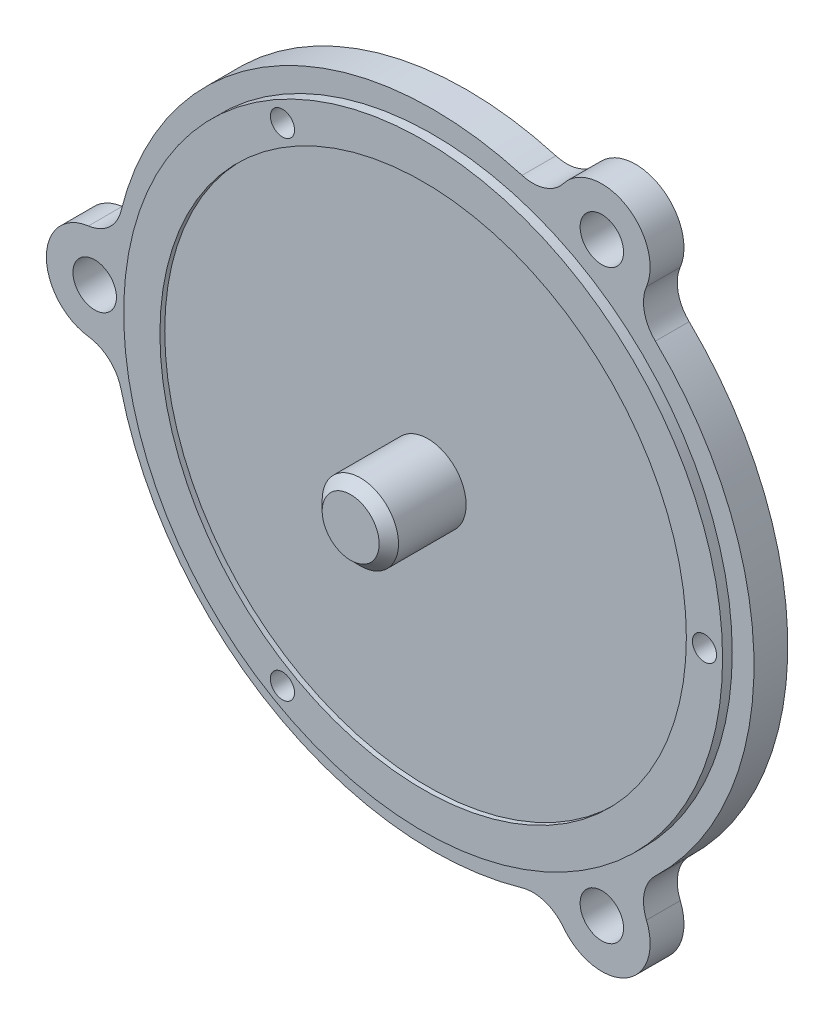
from build123d import *

# Parameters (mm, degrees)
ESQUISSE1_R                        = 31.25
BOSS_EXTRU_1_DEPTH                 = 2
BOSS_EXTRU_2_DEPTH                 = 25.5
BOSS_EXTRU_2_DEPTH_BACK            = 2
ESQUISSE2_R                        = 33.25
ESQUISSE2_R_2                      = 31.25
ESQUISSE3_R                        = 7.95
BOSS_EXTRU_3_DEPTH                 = 7.5
ESQUISSE4_R                        = 3.95
BOSS_EXTRU_4_DEPTH                 = 8
CHANFREIN1_SIZE                    = 1
BOSS_EXTRU_5_DEPTH                 = 27.5
ESQUISSE6_R                        = 1.75
ENL_V_MAT_EXTRU_1_DEPTH            = 10
CONG_1_R                           = 4
R_P_TITION_CIRCULAIRE2_COUNT       = 3
CONG_1_OF_R_P_TITION_CIRCULAIRE2_R = 4
ENL_V_MAT_EXTRU_2_DEPTH            = 25.5
ESQUISSE8_R                        = 3.95
BOSS_EXTRU_6_DEPTH                 = 8
ESQUISSE9_R                        = 2.25
ENL_V_MAT_EXTRU_3_DEPTH            = 54.952376281
CHANFREIN2_SIZE                    = 1
ESQUISSE10_R                       = 31
ESQUISSE10_R_2                     = 27.25
BOSS_EXTRU_7_DEPTH                 = 0.5
ESQUISSE11_R                       = 31
ENL_V_MAT_EXTRU_4_DEPTH            = 0.5
ESQUISSE12_R                       = 2.25
BOSS_EXTRU_8_DEPTH                 = 2
ESQUISSE13_R                       = 1.25
ENL_V_MAT_EXTRU_5_DEPTH            = 54.88050581


with BuildPart() as part:
    # Esquisse1 → Boss.-Extru.1 (new body)
    with BuildSketch(Plane.XY):
        Circle(ESQUISSE1_R)
    extrude(amount=BOSS_EXTRU_1_DEPTH)

    # Esquisse2 → Boss.-Extru.2 (add, two sides: drawn at the far end of the back side and taken through both)
    with BuildSketch(Plane.XY.offset(2).offset(-BOSS_EXTRU_2_DEPTH_BACK)):
        Circle(ESQUISSE2_R)
        Circle(ESQUISSE2_R_2, mode=Mode.SUBTRACT)
    extrude(amount=BOSS_EXTRU_2_DEPTH + BOSS_EXTRU_2_DEPTH_BACK)

    # Esquisse3 → Boss.-Extru.3 (add)
    with BuildSketch(Plane.XY.offset(2)):
        Circle(ESQUISSE3_R)
    extrude(amount=BOSS_EXTRU_3_DEPTH)

    # Esquisse4 → Boss.-Extru.4 (add)
    with BuildSketch(Plane.XY.offset(9.5)):
        Circle(ESQUISSE4_R)
    extrude(amount=BOSS_EXTRU_4_DEPTH)

    # Chanfrein1
    chanfrein1_edges = [part.edges().sort_by_distance(p)[0] for p in [
        (-7.95, 0, 9.5),
        (-3.95, 0, 17.5),
    ]]
    chamfer(chanfrein1_edges, length=CHANFREIN1_SIZE)

    # Esquisse5 → Boss.-Extru.5 (add)
    with BuildSketch(Plane.XY.offset(27.5)):
        with BuildLine():
            ThreePointArc((-32.936607143, -4.554383594), (-40, 0), (-32.936607143, 4.554383594))
            ThreePointArc((-32.936607143, 4.554383594), (-33.25, 0), (-32.936607143, -4.554383594))
        make_face()
    boss_extru_5 = extrude(amount=-BOSS_EXTRU_5_DEPTH)

    # Esquisse6 → Enlèv. mat.-Extru.1 (cut)
    with BuildSketch(Plane.XY.offset(27.5)):
        with Locations((-35, 0)):
            Circle(ESQUISSE6_R)
    enl_v_mat_extru_1 = extrude(amount=-ENL_V_MAT_EXTRU_1_DEPTH, mode=Mode.SUBTRACT)

    # Congé1
    cong_1_edges = [part.edges().sort_by_distance(p)[0] for p in [
        (-32.936607143, 4.554383594, 13.75),
        (-32.936607143, -4.554383594, 13.75),
    ]]
    fillet(cong_1_edges, radius=CONG_1_R)

    # Répétition circulaire2: Boss.-Extru.5, Enlèv. mat.-Extru.1 ×3 about axis
    r_p_tition_circulaire2_axis = Axis((0, 0, 0), (0, 0, 1))
    add([boss_extru_5.rotate(r_p_tition_circulaire2_axis, i * 360 / R_P_TITION_CIRCULAIRE2_COUNT) for i in range(1, R_P_TITION_CIRCULAIRE2_COUNT)])
    add([enl_v_mat_extru_1.rotate(r_p_tition_circulaire2_axis, i * 360 / R_P_TITION_CIRCULAIRE2_COUNT) for i in range(1, R_P_TITION_CIRCULAIRE2_COUNT)], mode=Mode.SUBTRACT)

    # Congé1 of Répétition circulaire2
    cong_1_of_r_p_tition_circulaire2_edges = [part.edges().sort_by_distance(p)[0] for p in [
        (12.524091681, -30.801130297, 13.75),
        (20.412515462, -26.246746703, 13.75),
        (20.412515462, 26.246746703, 13.75),
        (12.524091681, 30.801130297, 13.75),
    ]]
    fillet(cong_1_of_r_p_tition_circulaire2_edges, radius=CONG_1_OF_R_P_TITION_CIRCULAIRE2_R)

    # Esquisse7 → Enlèv. mat.-Extru.2 (cut)
    with BuildSketch(Plane.XY.offset(27.5)):
        with BuildLine():
            ThreePointArc((-35.647321429, 4.957920428), (-40, 0), (-35.647321429, -4.957920428))
            ThreePointArc((-35.647321429, -4.957920428), (-33.49964623, -5.941818617), (-32.281669463, -7.965947318))
            ThreePointArc((-32.281669463, -7.965947318), (-16.625, -28.795344676), (9.242121989, -31.939719491))
            ThreePointArc((9.242121989, -31.939719491), (11.604057248, -31.982453961), (13.529975674, -33.350446148))
            ThreePointArc((13.529975674, -33.350446148), (20, -34.641016151), (22.117345755, -28.39252572))
            ThreePointArc((22.117345755, -28.39252572), (21.895588982, -26.040635345), (23.039547474, -23.973772173))
            ThreePointArc((23.039547474, -23.973772173), (33.25, 0), (23.039547474, 23.973772173))
            ThreePointArc((23.039547474, 23.973772173), (21.895588982, 26.040635345), (22.117345755, 28.39252572))
            ThreePointArc((22.117345755, 28.39252572), (20, 34.641016151), (13.529975674, 33.350446148))
            ThreePointArc((13.529975674, 33.350446148), (11.604057248, 31.982453961), (9.242121989, 31.939719491))
            ThreePointArc((9.242121989, 31.939719491), (-16.625, 28.795344676), (-32.281669463, 7.965947318))
            ThreePointArc((-32.281669463, 7.965947318), (-33.49964623, 5.941818617), (-35.647321429, 4.957920428))
        make_face()
    extrude(amount=-ENL_V_MAT_EXTRU_2_DEPTH, mode=Mode.SUBTRACT)

    # Esquisse8 → Boss.-Extru.6 (add)
    with BuildSketch(Plane.XY.offset(2)):
        Circle(ESQUISSE8_R)
    extrude(amount=BOSS_EXTRU_6_DEPTH)

    # Esquisse9 → Enlèv. mat.-Extru.3 (cut, through all)
    with BuildSketch(Plane.XY.offset(2)):
        with Locations((-35, 0)):
            Circle(ESQUISSE9_R)
        with Locations((17.5, 30.310889132)):
            Circle(ESQUISSE9_R)
        with Locations((17.5, -30.310889132)):
            Circle(ESQUISSE9_R)
    extrude(amount=-ENL_V_MAT_EXTRU_3_DEPTH, mode=Mode.SUBTRACT)

    # Chanfrein2
    chanfrein2_edges = [part.edges().sort_by_distance(p)[0] for p in [
        (-3.95, 0, 10),
    ]]
    chamfer(chanfrein2_edges, length=CHANFREIN2_SIZE)

    # Esquisse10 → Boss.-Extru.7 (add)
    with BuildSketch(Plane.XY.offset(2)):
        Circle(ESQUISSE10_R)
        Circle(ESQUISSE10_R_2, mode=Mode.SUBTRACT)
    extrude(amount=BOSS_EXTRU_7_DEPTH)

    # Esquisse11 → Enlèv. mat.-Extru.4 (cut)
    with BuildSketch(Plane.XY.offset(2)):
        with BuildLine():
            ThreePointArc((-35.647321429, 4.957920428), (-33.49964623, 5.941818617), (-32.281669463, 7.965947318))
            ThreePointArc((-32.281669463, 7.965947318), (-16.625, 28.795344676), (9.242121989, 31.939719491))
            ThreePointArc((9.242121989, 31.939719491), (11.604057248, 31.982453961), (13.529975674, 33.350446148))
            ThreePointArc((13.529975674, 33.350446148), (20, 34.641016151), (22.117345755, 28.39252572))
            ThreePointArc((22.117345755, 28.39252572), (21.895588982, 26.040635345), (23.039547474, 23.973772173))
            ThreePointArc((23.039547474, 23.973772173), (33.25, 0), (23.039547474, -23.973772173))
            ThreePointArc((23.039547474, -23.973772173), (21.895588982, -26.040635345), (22.117345755, -28.39252572))
            ThreePointArc((22.117345755, -28.39252572), (20, -34.641016151), (13.529975674, -33.350446148))
            ThreePointArc((13.529975674, -33.350446148), (11.604057248, -31.982453961), (9.242121989, -31.939719491))
            ThreePointArc((9.242121989, -31.939719491), (-16.625, -28.795344676), (-32.281669463, -7.965947318))
            ThreePointArc((-32.281669463, -7.965947318), (-33.49964623, -5.941818617), (-35.647321429, -4.957920428))
            ThreePointArc((-35.647321429, -4.957920428), (-40, 0), (-35.647321429, 4.957920428))
        make_face()
        Circle(ESQUISSE11_R, mode=Mode.SUBTRACT)
    extrude(amount=-ENL_V_MAT_EXTRU_4_DEPTH, mode=Mode.SUBTRACT)

    # Esquisse12 → Boss.-Extru.8 (add)
    with BuildSketch(Plane(origin=(0, 0, 0), x_dir=(-1, 0, 0), z_dir=(0, 0, -1))):
        with BuildLine():
            ThreePointArc((35.647321429, -4.957920428), (40, 0), (35.647321429, 4.957920428))
            ThreePointArc((35.647321429, 4.957920428), (33.49964623, 5.941818617), (32.281669463, 7.965947318))
            ThreePointArc((32.281669463, 7.965947318), (16.625, 28.795344676), (-9.242121989, 31.939719491))
            ThreePointArc((-9.242121989, 31.939719491), (-11.604057248, 31.982453961), (-13.529975674, 33.350446148))
            ThreePointArc((-13.529975674, 33.350446148), (-20, 34.641016151), (-22.117345755, 28.39252572))
            ThreePointArc((-22.117345755, 28.39252572), (-21.895588982, 26.040635345), (-23.039547474, 23.973772173))
            ThreePointArc((-23.039547474, 23.973772173), (-33.25, 0), (-23.039547474, -23.973772173))
            ThreePointArc((-23.039547474, -23.973772173), (-21.895588982, -26.040635345), (-22.117345755, -28.39252572))
            ThreePointArc((-22.117345755, -28.39252572), (-20, -34.641016151), (-13.529975674, -33.350446148))
            ThreePointArc((-13.529975674, -33.350446148), (-11.604057248, -31.982453961), (-9.242121989, -31.939719491))
            ThreePointArc((-9.242121989, -31.939719491), (16.625, -28.795344676), (32.281669463, -7.965947318))
            ThreePointArc((32.281669463, -7.965947318), (33.49964623, -5.941818617), (35.647321429, -4.957920428))
        make_face()
        with Locations(Location((35, 0, 0), (0, 0, 180))):
            Circle(ESQUISSE12_R, mode=Mode.SUBTRACT)
        with Locations(Location((-17.5, -30.310889132, 0), (0, 0, 180))):
            Circle(ESQUISSE12_R, mode=Mode.SUBTRACT)
        with Locations(Location((-17.5, 30.310889132, 0), (0, 0, 180))):
            Circle(ESQUISSE12_R, mode=Mode.SUBTRACT)
    extrude(amount=BOSS_EXTRU_8_DEPTH)

    # Esquisse13 → Enlèv. mat.-Extru.5 (cut, through all)
    with BuildSketch(Plane.XY.offset(2.5)):
        with Locations((-14.5625, 25.222989885)):
            Circle(ESQUISSE13_R)
        with Locations((29.125, 0)):
            Circle(ESQUISSE13_R)
        with Locations((-14.5625, -25.222989885)):
            Circle(ESQUISSE13_R)
    extrude(amount=-ENL_V_MAT_EXTRU_5_DEPTH, mode=Mode.SUBTRACT)


solid = part.part
